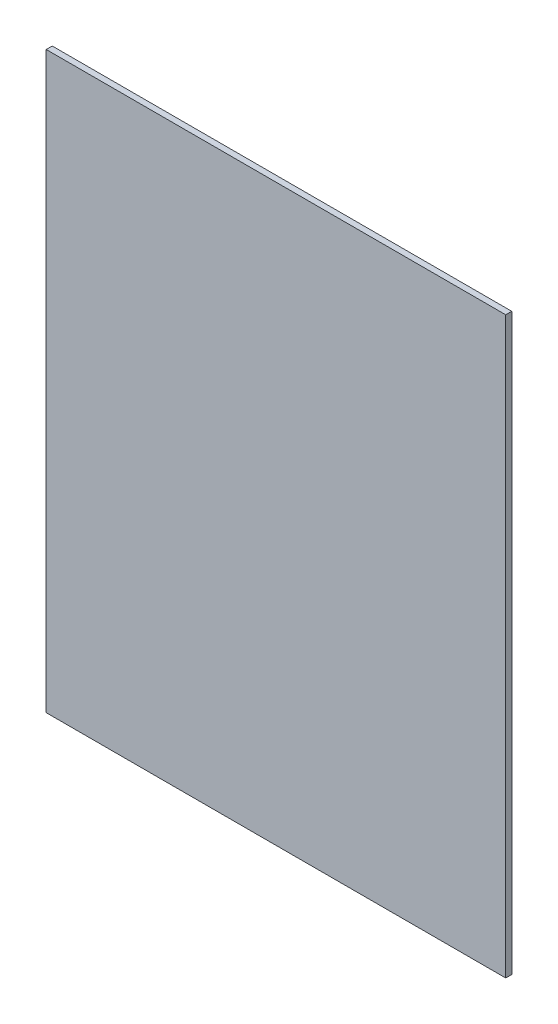
from build123d import *

# Parameters (mm, degrees)
SKETCH1_W           = 152
SKETCH1_H           = 190
BOSS_EXTRUDE1_DEPTH = 2


with BuildPart() as part:
    # Sketch1 → Boss-Extrude1 (new body)
    with BuildSketch(Plane.XY):
        Rectangle(SKETCH1_W, SKETCH1_H)
    extrude(amount=BOSS_EXTRUDE1_DEPTH)


solid = part.part
